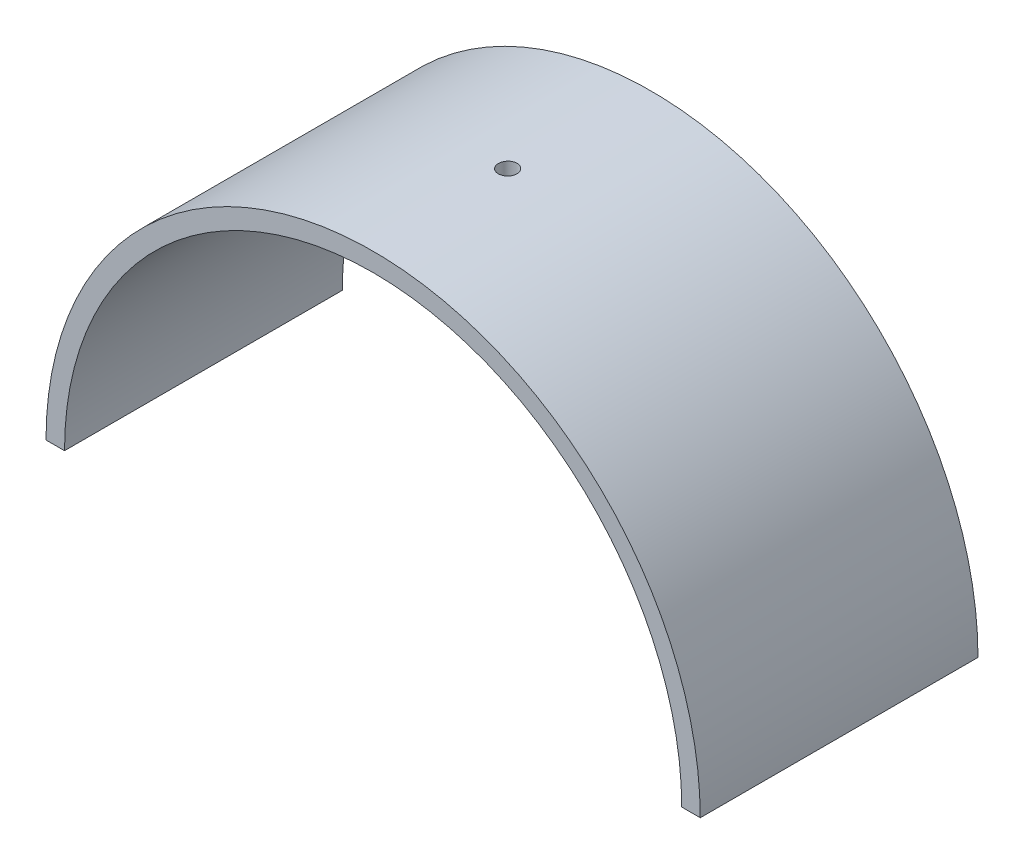
from build123d import *

# Parameters (mm, degrees)
SKETCH1_W          = 3
SKETCH1_H          = 45
REVOLVE1_ANGLE     = 180
SKETCH2_R          = 1.5
CUT_EXTRUDE1_DEPTH = 10


with BuildPart() as part:
    # Sketch1 → Revolve1 (revolve)
    with BuildSketch(Plane(origin=(0, 0, 0), x_dir=(1, 0, 0), z_dir=(0, 1, 0))):
        Rectangle(SKETCH1_W, SKETCH1_H)
    revolve(axis=Axis((-51.5, 0, -27.834324949), (0, 0, 1)), revolution_arc=REVOLVE1_ANGLE)

    # Sketch2 → Cut-Extrude1 (cut)
    with BuildSketch(Plane(origin=(0, 54, 0), x_dir=(1, 0, 0), z_dir=(0, 1, 0))):
        with Locations(Location((-52.203545166, 0, 0), (0, 0, 270))):
            Circle(SKETCH2_R)
    extrude(amount=-CUT_EXTRUDE1_DEPTH, mode=Mode.SUBTRACT)


solid = part.part
